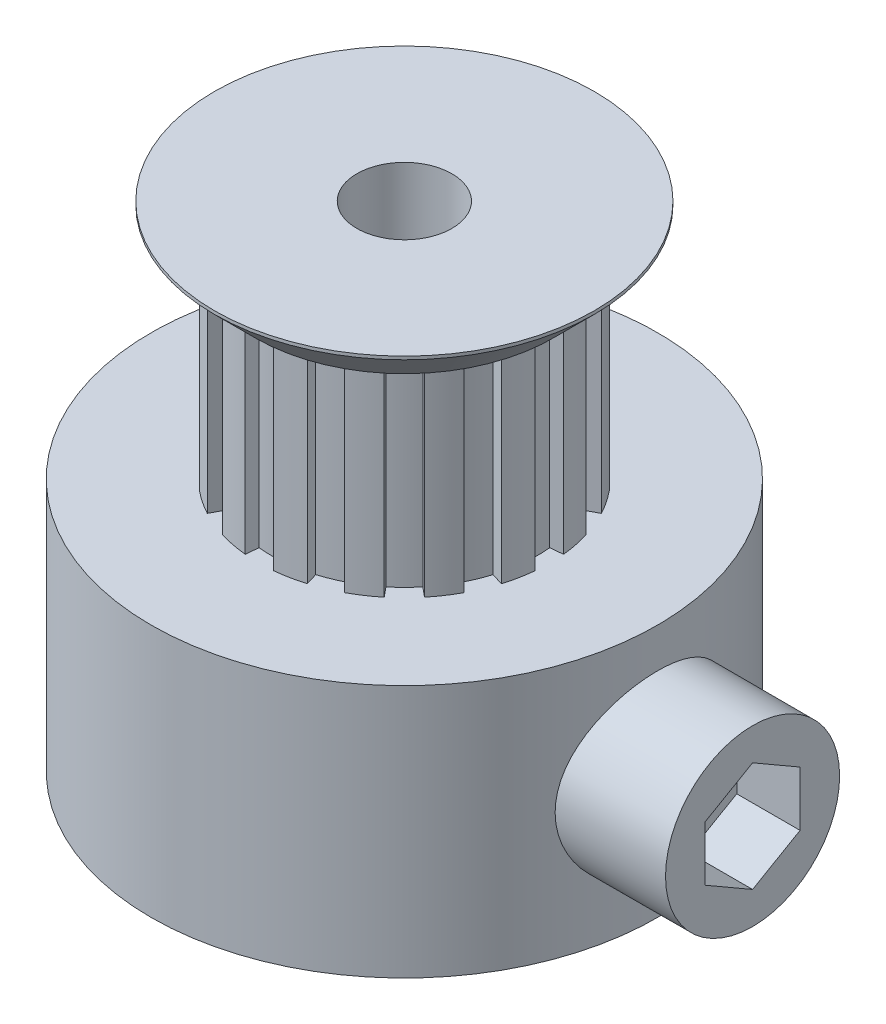
from build123d import *

# Parameters (mm, degrees)
SKETCH1_R           = 8
BOSS_EXTRUDE1_DEPTH = 8
SKETCH2_R           = 4.6
BOSS_EXTRUDE2_DEPTH = 6.2
CUT_EXTRUDE2_START  = -6.2
CUT_EXTRUDE2_DEPTH  = 6.2
SKETCH3_R           = 6
BOSS_EXTRUDE3_DEPTH = 1.4
CHAMFER1_SIZE       = 1.3
SKETCH4_R           = 2.75
BOSS_EXTRUDE4_DEPTH = 11
CUT_EXTRUDE1_DEPTH  = 2
SKETCH7_R           = 1.5
CUT_EXTRUDE3_DEPTH  = 21.696859757


with BuildPart() as part:
    # Sketch1 → Boss-Extrude1 (new body)
    with BuildSketch(Plane(origin=(0, 0, 0), x_dir=(1, 0, 0), z_dir=(0, 1, 0))):
        with Locations(Location((0, 0, 0), (0, 0, 270))):
            Circle(SKETCH1_R)
    extrude(amount=BOSS_EXTRUDE1_DEPTH)

    # Sketch2 → Boss-Extrude2 (add)
    with BuildSketch(Plane(origin=(0, 8, 0), x_dir=(1, 0, 0), z_dir=(0, 1, 0))):
        with Locations(Location((0, 0, 0), (0, 0, 90))):
            Circle(SKETCH2_R)
    extrude(amount=BOSS_EXTRUDE2_DEPTH)

    # Sketch6 → Cut-Extrude2 (cut)
    with BuildSketch(Plane(origin=(0, 14.2, 0), x_dir=(1, 0, 0), z_dir=(0, 1, 0)).offset(CUT_EXTRUDE2_START)):
        with BuildLine():
            Line((-0.450878846, 4.577849743), (-0.411671989, 4.179775852))
            ThreePointArc((-0.411671989, 4.179775852), (0, 4.2), (0.411671989, 4.179775852))
            Line((0.411671989, 4.179775852), (0.450878846, 4.577849743))
            ThreePointArc((0.450878846, 4.577849743), (0, 4.6), (-0.450878846, 4.577849743))
        make_face()
        with BuildLine():
            Line((2.168424989, 4.056837816), (1.979866295, 3.70406931))
            ThreePointArc((1.979866295, 3.70406931), (1.607270416, 3.880294037), (1.219195644, 4.01914941))
            Line((1.219195644, 4.01914941), (1.335309515, 4.401925544))
            ThreePointArc((1.335309515, 4.401925544), (1.760343789, 4.24984585), (2.168424989, 4.056837816))
        make_face()
        with BuildLine():
            Line((3.555848085, 2.918209107), (3.246643904, 2.664451793))
            ThreePointArc((3.246643904, 2.664451793), (2.969848481, 2.969848481), (2.664451793, 3.246643904))
            Line((2.664451793, 3.246643904), (2.918209107, 3.555848085))
            ThreePointArc((2.918209107, 3.555848085), (3.252691193, 3.252691193), (3.555848085, 2.918209107))
        make_face()
        with BuildLine():
            Line((4.401925544, 1.335309515), (4.01914941, 1.219195644))
            ThreePointArc((4.01914941, 1.219195644), (3.880294037, 1.607270416), (3.70406931, 1.979866295))
            Line((3.70406931, 1.979866295), (4.056837816, 2.168424989))
            ThreePointArc((4.056837816, 2.168424989), (4.24984585, 1.760343789), (4.401925544, 1.335309515))
        make_face()
        with BuildLine():
            Line((4.577849743, -0.450878846), (4.179775852, -0.411671989))
            ThreePointArc((4.179775852, -0.411671989), (4.2, 0), (4.179775852, 0.411671989))
            Line((4.179775852, 0.411671989), (4.577849743, 0.450878846))
            ThreePointArc((4.577849743, 0.450878846), (4.6, 0), (4.577849743, -0.450878846))
        make_face()
        with BuildLine():
            Line((4.056837816, -2.168424989), (3.70406931, -1.979866295))
            ThreePointArc((3.70406931, -1.979866295), (3.880294037, -1.607270416), (4.01914941, -1.219195644))
            Line((4.01914941, -1.219195644), (4.401925544, -1.335309515))
            ThreePointArc((4.401925544, -1.335309515), (4.24984585, -1.760343789), (4.056837816, -2.168424989))
        make_face()
        with BuildLine():
            Line((2.918209107, -3.555848085), (2.664451793, -3.246643904))
            ThreePointArc((2.664451793, -3.246643904), (2.969848481, -2.969848481), (3.246643904, -2.664451793))
            Line((3.246643904, -2.664451793), (3.555848085, -2.918209107))
            ThreePointArc((3.555848085, -2.918209107), (3.252691193, -3.252691193), (2.918209107, -3.555848085))
        make_face()
        with BuildLine():
            Line((1.335309515, -4.401925544), (1.219195644, -4.01914941))
            ThreePointArc((1.219195644, -4.01914941), (1.607270416, -3.880294037), (1.979866295, -3.70406931))
            Line((1.979866295, -3.70406931), (2.168424989, -4.056837816))
            ThreePointArc((2.168424989, -4.056837816), (1.760343789, -4.24984585), (1.335309515, -4.401925544))
        make_face()
        with BuildLine():
            Line((-0.450878846, -4.577849743), (-0.411671989, -4.179775852))
            ThreePointArc((-0.411671989, -4.179775852), (0, -4.2), (0.411671989, -4.179775852))
            Line((0.411671989, -4.179775852), (0.450878846, -4.577849743))
            ThreePointArc((0.450878846, -4.577849743), (0, -4.6), (-0.450878846, -4.577849743))
        make_face()
        with BuildLine():
            Line((-2.168424989, -4.056837816), (-1.979866295, -3.70406931))
            ThreePointArc((-1.979866295, -3.70406931), (-1.607270416, -3.880294037), (-1.219195644, -4.01914941))
            Line((-1.219195644, -4.01914941), (-1.335309515, -4.401925544))
            ThreePointArc((-1.335309515, -4.401925544), (-1.760343789, -4.24984585), (-2.168424989, -4.056837816))
        make_face()
        with BuildLine():
            Line((-3.555848085, -2.918209107), (-3.246643904, -2.664451793))
            ThreePointArc((-3.246643904, -2.664451793), (-2.969848481, -2.969848481), (-2.664451793, -3.246643904))
            Line((-2.664451793, -3.246643904), (-2.918209107, -3.555848085))
            ThreePointArc((-2.918209107, -3.555848085), (-3.252691193, -3.252691193), (-3.555848085, -2.918209107))
        make_face()
        with BuildLine():
            Line((-4.401925544, -1.335309515), (-4.01914941, -1.219195644))
            ThreePointArc((-4.01914941, -1.219195644), (-3.880294037, -1.607270416), (-3.70406931, -1.979866295))
            Line((-3.70406931, -1.979866295), (-4.056837816, -2.168424989))
            ThreePointArc((-4.056837816, -2.168424989), (-4.24984585, -1.760343789), (-4.401925544, -1.335309515))
        make_face()
        with BuildLine():
            Line((-4.577849743, 0.450878846), (-4.179775852, 0.411671989))
            ThreePointArc((-4.179775852, 0.411671989), (-4.2, 0), (-4.179775852, -0.411671989))
            Line((-4.179775852, -0.411671989), (-4.577849743, -0.450878846))
            ThreePointArc((-4.577849743, -0.450878846), (-4.6, 0), (-4.577849743, 0.450878846))
        make_face()
        with BuildLine():
            Line((-4.056837816, 2.168424989), (-3.70406931, 1.979866295))
            ThreePointArc((-3.70406931, 1.979866295), (-3.880294037, 1.607270416), (-4.01914941, 1.219195644))
            Line((-4.01914941, 1.219195644), (-4.401925544, 1.335309515))
            ThreePointArc((-4.401925544, 1.335309515), (-4.24984585, 1.760343789), (-4.056837816, 2.168424989))
        make_face()
        with BuildLine():
            Line((-2.918209107, 3.555848085), (-2.664451793, 3.246643904))
            ThreePointArc((-2.664451793, 3.246643904), (-2.969848481, 2.969848481), (-3.246643904, 2.664451793))
            Line((-3.246643904, 2.664451793), (-3.555848085, 2.918209107))
            ThreePointArc((-3.555848085, 2.918209107), (-3.252691193, 3.252691193), (-2.918209107, 3.555848085))
        make_face()
        with BuildLine():
            Line((-1.335309515, 4.401925544), (-1.219195644, 4.01914941))
            ThreePointArc((-1.219195644, 4.01914941), (-1.607270416, 3.880294037), (-1.979866295, 3.70406931))
            Line((-1.979866295, 3.70406931), (-2.168424989, 4.056837816))
            ThreePointArc((-2.168424989, 4.056837816), (-1.760343789, 4.24984585), (-1.335309515, 4.401925544))
        make_face()
    extrude(amount=CUT_EXTRUDE2_DEPTH, mode=Mode.SUBTRACT)

    # Sketch3 → Boss-Extrude3 (add)
    with BuildSketch(Plane(origin=(0, 14.2, 0), x_dir=(1, 0, 0), z_dir=(0, 1, 0))):
        with Locations(Location((0, 0, 0), (0, 0, 270))):
            Circle(SKETCH3_R)
    extrude(amount=BOSS_EXTRUDE3_DEPTH)

    # Chamfer1
    chamfer1_edges = [part.edges().sort_by_distance(p)[0] for p in [
        (0, 14.2, -6),
    ]]
    chamfer(chamfer1_edges, length=CHAMFER1_SIZE)

    # Sketch4 → Boss-Extrude4 (add)
    with BuildSketch(Plane(origin=(0, 0, 0), x_dir=(0, 0, -1), z_dir=(1, 0, 0))):
        with Locations(Location((0, 4, 0), (0, 0, 180))):
            Circle(SKETCH4_R)
    extrude(amount=BOSS_EXTRUDE4_DEPTH)

    # Sketch5 → Cut-Extrude1 (cut)
    with BuildSketch(Plane(origin=(11, 0, 0), x_dir=(0, 0, -1), z_dir=(1, 0, 0))):
        Polygon((0, 2.267949192), (1.5, 3.133974596), (1.5, 4.866025404), (0, 5.732050808), (-1.5, 4.866025404), (-1.5, 3.133974596), align=None)
    extrude(amount=-CUT_EXTRUDE1_DEPTH, mode=Mode.SUBTRACT)

    # Sketch7 → Cut-Extrude3 (cut, through all)
    with BuildSketch(Plane.XZ):
        with Locations(Location((0, 0, 0), (0, 0, 270))):
            Circle(SKETCH7_R)
    extrude(amount=-CUT_EXTRUDE3_DEPTH, mode=Mode.SUBTRACT)


solid = part.part
